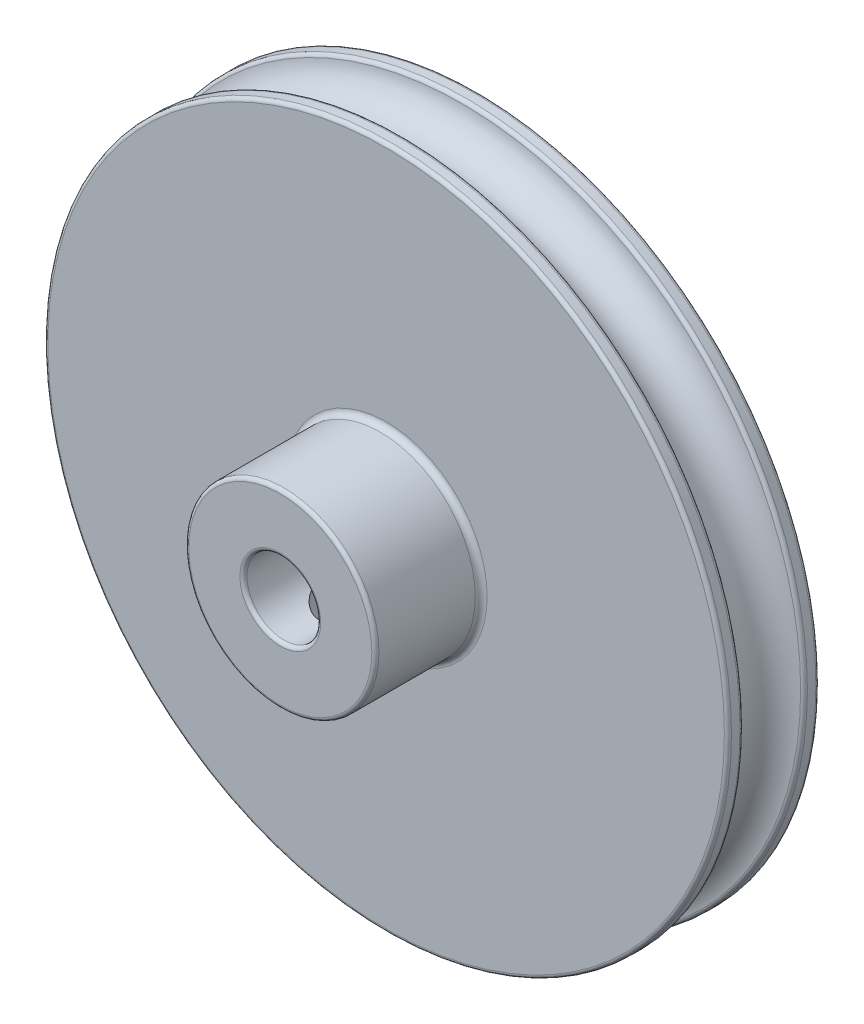
from build123d import *

# Parameters (mm, degrees)
SKETCH1_R           = 28.75
BOSS_EXTRUDE1_DEPTH = 3.85
SKETCH2_R           = 2.55
SKETCH4_R           = 8
BOSS_EXTRUDE2_DEPTH = 8.9
SKETCH5_R           = 3.1
CUT_EXTRUDE1_DEPTH  = 15.6
SKETCH6_R           = 2
CUT_EXTRUDE2_DEPTH  = 43.61088476
FILLET1_R           = 0.5
FILLET2_R           = 0.3


with BuildPart() as part:
    # Sketch1 → Boss-Extrude1 (new, symmetric)
    with BuildSketch(Plane.XY):
        with Locations(Location((0, 0, 0), (0, 0, 180))):
            Circle(SKETCH1_R)
    extrude(amount=BOSS_EXTRUDE1_DEPTH, both=True)

    # Cut-Sweep1: sweep along a curve in space
    with BuildLine() as cut_sweep1_path:
        ThreePointArc((28.75, 0, -3.85), (20.329319959, 20.329319959, -3.85), (0, 28.75, -3.85))
        ThreePointArc((0, 28.75, -3.85), (-20.329319959, 20.329319959, -3.85), (-28.75, 0, -3.85))
        ThreePointArc((-28.75, 0, -3.85), (-20.329319959, -20.329319959, -3.85), (0, -28.75, -3.85))
        ThreePointArc((0, -28.75, -3.85), (20.329319959, -20.329319959, -3.85), (28.75, 0, -3.85))
    # Sketch2 → Cut-Sweep1 (sweep, cut)
    with BuildSketch(Plane(origin=(0, 0, 0), x_dir=(1, 0, 0), z_dir=(0, 1, 0))):
        with Locations((28.75, 0)):
            Circle(SKETCH2_R)
    sweep(path=cut_sweep1_path.line, mode=Mode.SUBTRACT)

    # Sketch4 → Boss-Extrude2 (add)
    with BuildSketch(Plane.XY.offset(3.85)):
        Circle(SKETCH4_R)
    extrude(amount=BOSS_EXTRUDE2_DEPTH)

    # Sketch5 → Cut-Extrude1 (cut)
    with BuildSketch(Plane.XY.offset(12.75)):
        Circle(SKETCH5_R)
    extrude(amount=-CUT_EXTRUDE1_DEPTH, mode=Mode.SUBTRACT)

    # Sketch6 → Cut-Extrude2 (cut, through all)
    with BuildSketch(Plane(origin=(0, 0, 0), x_dir=(1, 0, 0), z_dir=(0, 1, 0))):
        with Locations(Location((0, -7.5, 0), (0, 0, 270))):
            Circle(SKETCH6_R)
    extrude(amount=-CUT_EXTRUDE2_DEPTH, mode=Mode.SUBTRACT)

    # Fillet1
    fillet1_edges = [part.edges().sort_by_distance(p)[0] for p in [
        (-8, 0, 3.85),
    ]]
    fillet(fillet1_edges, radius=FILLET1_R)

    # Fillet2
    fillet2_edges = [part.edges().sort_by_distance(p)[0] for p in [
        (-8, 0, 12.75),
        (-3.1, 0, 12.75),
        (28.75, 0, -3.85),
        (28.75, 0, 3.85),
        (20.329319959, 20.329319959, -2.55),
        (-20.329319959, 20.329319959, 2.55),
    ]]
    fillet(fillet2_edges, radius=FILLET2_R)


solid = part.part
